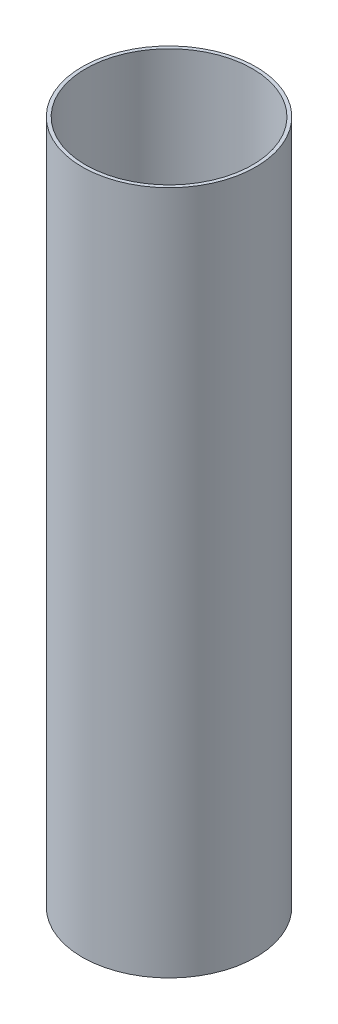
from build123d import *

# Parameters (mm, degrees)
SKETCH1_R           = 51.562
SKETCH1_R_2         = 49.53
BOSS_EXTRUDE1_DEPTH = 406.4


with BuildPart() as part:
    # Sketch1 → Boss-Extrude1 (new body)
    with BuildSketch(Plane(origin=(0, 0, 0), x_dir=(1, 0, 0), z_dir=(0, 1, 0))):
        with Locations(Location((0, 0, 0), (0, 0, 270))):
            Circle(SKETCH1_R)
        with Locations(Location((0, 0, 0), (0, 0, 270))):
            Circle(SKETCH1_R_2, mode=Mode.SUBTRACT)
    extrude(amount=BOSS_EXTRUDE1_DEPTH)


solid = part.part
